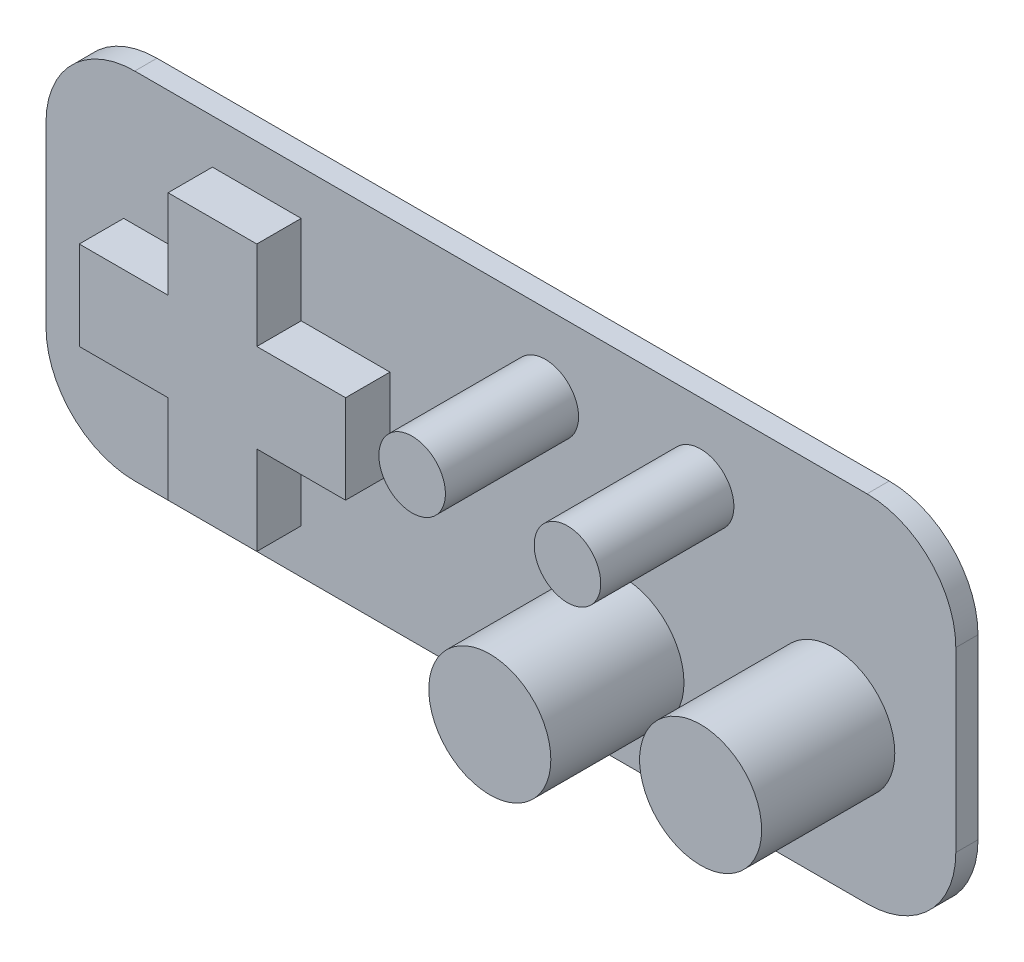
from build123d import *

# Parameters (mm, degrees)
EXTRUDE_1_DEPTH = 1
SKETCH_3_R      = 1.5
SKETCH_3_R_2    = 2.75
EXTRUDE_2_DEPTH = 6
EXTRUDE_3_DEPTH = 3


with BuildPart() as part:
    # 草图1 → 凸台-拉伸1 (new body)
    with BuildSketch(Plane.XY):
        with BuildLine():
            Line((-15.782608696, 8.75), (17.217391304, 8.75))
            ThreePointArc((17.217391304, 8.75), (20.045818429, 7.578427125), (21.217391304, 4.75))
            Line((21.217391304, 4.75), (21.217391304, -3.25))
            ThreePointArc((21.217391304, -3.25), (20.045818429, -6.078427125), (17.217391304, -7.25))
            Line((17.217391304, -7.25), (-15.782608696, -7.25))
            ThreePointArc((-15.782608696, -7.25), (-18.61103582, -6.078427125), (-19.782608696, -3.25))
            Line((-19.782608696, -3.25), (-19.782608696, 4.75))
            ThreePointArc((-19.782608696, 4.75), (-18.61103582, 7.578427125), (-15.782608696, 8.75))
        make_face()
    extrude(amount=EXTRUDE_1_DEPTH)

    # 草图3 → 凸台-拉伸2 (add)
    with BuildSketch(Plane.XY.offset(1)):
        with Locations((2.717391304, 5.25)):
            Circle(SKETCH_3_R)
        with Locations((9.717391304, 5.25)):
            Circle(SKETCH_3_R)
        with Locations((6.217391304, -2.75)):
            Circle(SKETCH_3_R_2)
        with Locations((15.717391304, -0.75)):
            Circle(SKETCH_3_R_2)
    extrude(amount=EXTRUDE_2_DEPTH)

    # 草图4 → 凸台-拉伸3 (add)
    with BuildSketch(Plane.XY):
        Polygon((-8.282608696, 2.75), (-8.282608696, 6.75), (-12.282608696, 6.75), (-12.282608696, 2.75), (-16.282608696, 2.75), (-16.282608696, -1.25), (-12.282608696, -1.25), (-12.282608696, -5.25), (-8.282608696, -5.25), (-8.282608696, -1.25), (-4.282608696, -1.25), (-4.282608696, 2.75), align=None)
    extrude(amount=EXTRUDE_3_DEPTH)


solid = part.part
